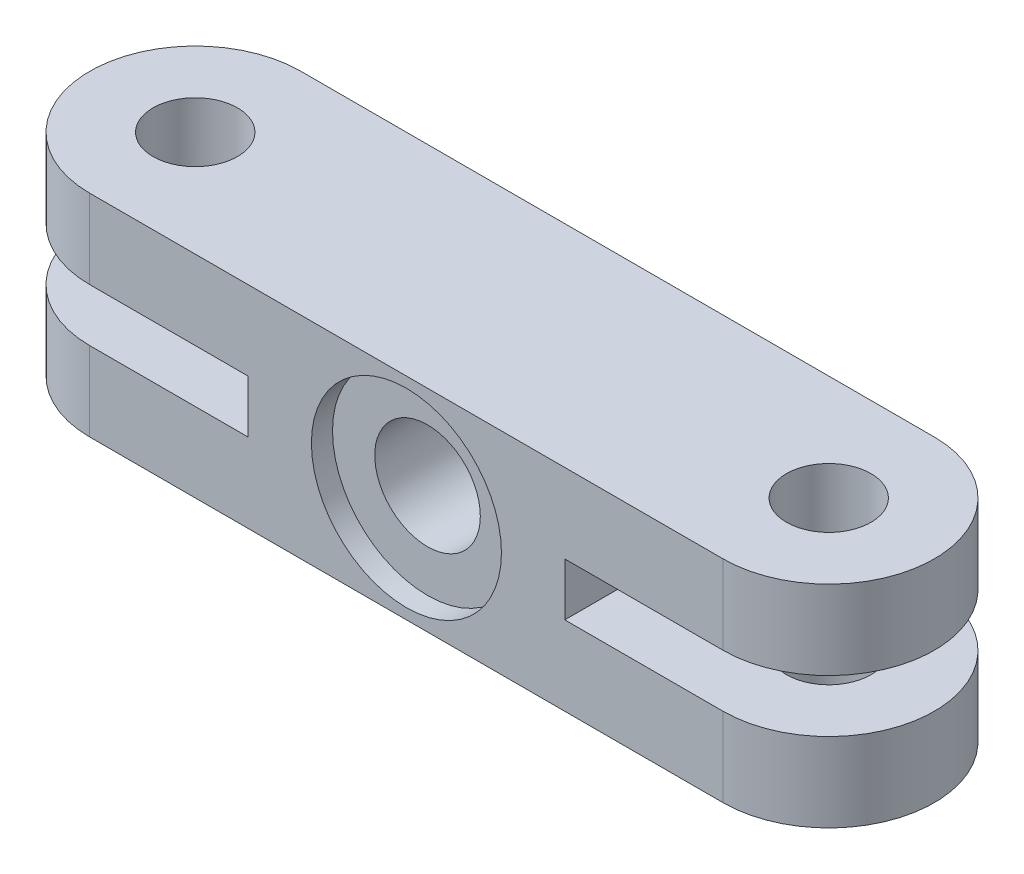
from build123d import *

# Parameters (mm, degrees)
SKETCH1_R           = 4
BOSS_EXTRUDE1_DEPTH = 10
SKETCH3_W           = 25
SKETCH3_H           = 5
CUT_EXTRUDE1_DEPTH  = 46.82575695
HOLE1_D             = 10
HOLE1_CBORE_D       = 18
HOLE1_CBORE_DEPTH   = 2


with BuildPart() as part:
    # Sketch1 → Boss-Extrude1 (new, symmetric)
    with BuildSketch(Plane(origin=(0, 0, 0), x_dir=(1, 0, 0), z_dir=(0, 1, 0))):
        with BuildLine():
            Line((-30, 10), (30, 10))
            ThreePointArc((30, 10), (40, 0), (30, -10))
            Line((30, -10), (-30, -10))
            ThreePointArc((-30, -10), (-40, 0), (-30, 10))
        make_face()
        with Locations(Location((-30, 0, 0), (0, 0, 270))):
            Circle(SKETCH1_R, mode=Mode.SUBTRACT)
        with Locations(Location((30, 0, 0), (0, 0, 270))):
            Circle(SKETCH1_R, mode=Mode.SUBTRACT)
    extrude(amount=BOSS_EXTRUDE1_DEPTH, both=True)

    # Sketch3 → Cut-Extrude1 (cut, through all)
    with BuildSketch(Plane.XY.offset(10)):
        with Locations((27.5, 0)):
            Rectangle(SKETCH3_W, SKETCH3_H)
        with Locations((-27.5, 0)):
            Rectangle(SKETCH3_W, SKETCH3_H)
    extrude(amount=-CUT_EXTRUDE1_DEPTH, mode=Mode.SUBTRACT)

    # Hole1 (through all)
    with Locations(Plane.XY.offset(10)):
        with Locations((0, 0)):
            CounterBoreHole(HOLE1_D / 2, HOLE1_CBORE_D / 2, HOLE1_CBORE_DEPTH)


solid = part.part
